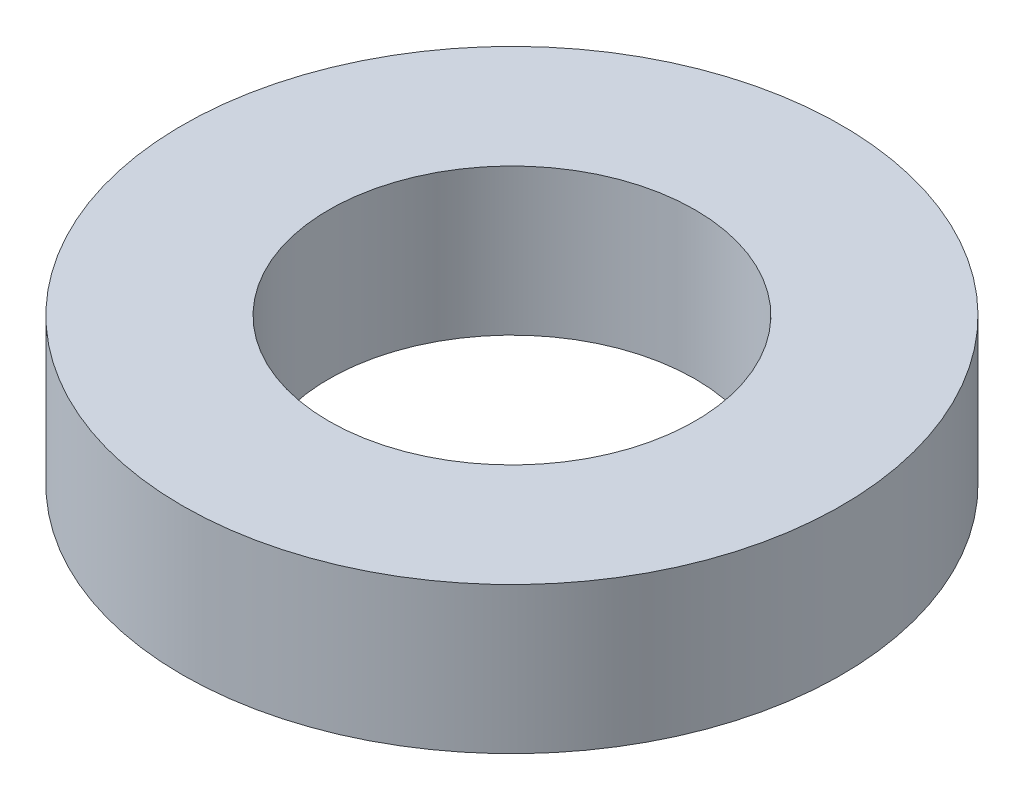
from build123d import *

# Parameters (mm, degrees)
SKETCH1_R           = 4.5
SKETCH1_R_2         = 2.5
BOSS_EXTRUDE1_DEPTH = 2


with BuildPart() as part:
    # Sketch1 → Boss-Extrude1 (new body)
    with BuildSketch(Plane(origin=(0, 0, 0), x_dir=(1, 0, 0), z_dir=(0, 1, 0))):
        with Locations(Location((0, 0, 0), (0, 0, 270))):
            Circle(SKETCH1_R)
        with Locations(Location((0, 0, 0), (0, 0, 270))):
            Circle(SKETCH1_R_2, mode=Mode.SUBTRACT)
    extrude(amount=BOSS_EXTRUDE1_DEPTH)


solid = part.part
